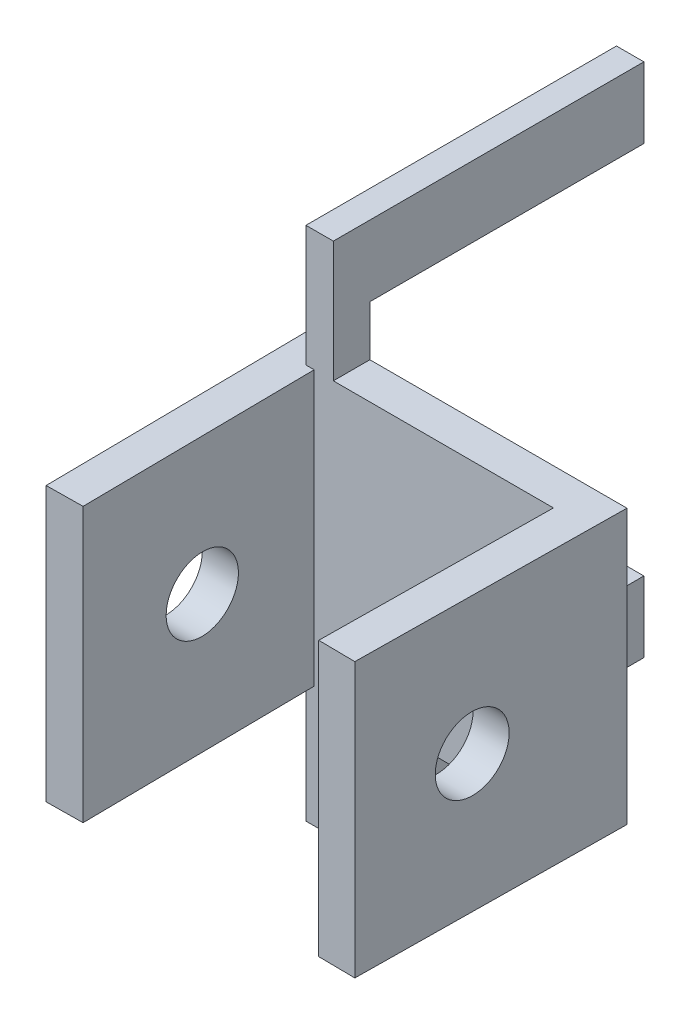
from build123d import *

# Parameters (mm, degrees)
BOSS_EXTRUDE1_DEPTH      = 30
SKETCH3_R                = 4
CUT_EXTRUDE1_DEPTH       = 40
SKETCH4_W                = 3
SKETCH4_H                = 41
BOSS_EXTRUDE2_DEPTH      = 4
BOSS_EXTRUDE3_DEPTH      = 30
BOSS_EXTRUDE3_DEPTH_BACK = 4
SKETCH5_W                = 3
SKETCH5_H                = 7.75


with BuildPart() as part:
    # Sketch1 → Boss-Extrude1 (new body)
    with BuildSketch(Plane(origin=(0, 0, 0), x_dir=(1, 0, 0), z_dir=(0, 1, 0))):
        Polygon((-12.8, -12.8), (-13.1, 12.8), (13.1, 12.8), (12.8, -12.6), (16.799721029, -12.6472408), (17.147523085, 16.8), (-17.147149649, 16.8), (-16.79972537, -12.846871782), align=None)
    extrude(amount=BOSS_EXTRUDE1_DEPTH)

    # Sketch3 → Cut-Extrude1 (cut)
    with BuildSketch(Plane(origin=(16.946733814, 0, 0.200158273), x_dir=(0.011810199887684227, 0, -0.9999302571572745), z_dir=(0.9999302571572745, 0, 0.011810199887684227))):
        with Locations(Location((0.252049318, 15, 0), (0, 0, 180))):
            Circle(SKETCH3_R)
    extrude(amount=-CUT_EXTRUDE1_DEPTH, mode=Mode.SUBTRACT)

    # Sketch4 → Boss-Extrude2 (add)
    with BuildSketch(Plane(origin=(0, 0, -16.8), x_dir=(-1, 0, 0), z_dir=(0, 0, -1))):
        with Locations((12.499813282, 15)):
            Rectangle(SKETCH4_W, SKETCH4_H)
    extrude(amount=-BOSS_EXTRUDE2_DEPTH)

    # Sketch5 → Boss-Extrude3 (add, two sides: drawn at the far end of the back side and taken through both)
    with BuildSketch(Plane(origin=(0, 0, -16.8), x_dir=(-1, 0, 0), z_dir=(0, 0, -1)).offset(-BOSS_EXTRUDE3_DEPTH_BACK)):
        with Locations((12.499813282, 39.375)):
            Rectangle(SKETCH5_W, SKETCH5_H)
        with Locations((12.499813282, -9.375)):
            Rectangle(SKETCH5_W, SKETCH5_H)
    extrude(amount=BOSS_EXTRUDE3_DEPTH + BOSS_EXTRUDE3_DEPTH_BACK)


solid = part.part
